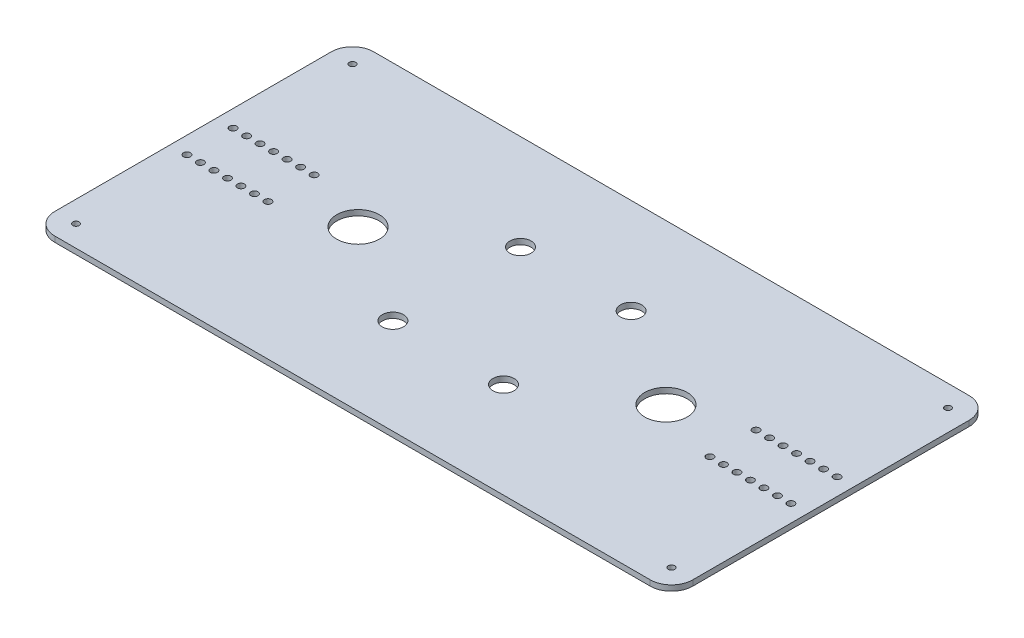
from build123d import *

# Parameters (mm, degrees)
SKETCH1_W               = 300
SKETCH1_H               = 150
BOSS_EXTRUDE1_DEPTH     = 2.6
FILLET1_R               = 10
SKETCH8_R               = 1.65
CUT_EXTRUDE4_DEPTH      = 2.6
LPATTERN1_COUNT         = 7
LPATTERN1_PITCH         = 6.35
MIRROR1_COPY_1_SKETCH_R = 1.65
MIRROR1_COPY_1_DEPTH    = 2.6
MIRROR1_COPY_2_SKETCH_R = 1.65
MIRROR1_COPY_2_DEPTH    = 2.6
MIRROR1_COPY_3_SKETCH_R = 1.65
MIRROR1_COPY_3_DEPTH    = 2.6
MIRROR1_COPY_4_SKETCH_R = 1.65
MIRROR1_COPY_4_DEPTH    = 2.6
MIRROR1_COPY_5_SKETCH_R = 1.65
MIRROR1_COPY_5_DEPTH    = 2.6
MIRROR1_COPY_6_SKETCH_R = 1.65
MIRROR1_COPY_6_DEPTH    = 2.6
SKETCH6_R               = 1.5
CUT_EXTRUDE6_DEPTH      = 2.6
MIRROR6_COPY_1_SKETCH_R = 1.5
MIRROR6_COPY_1_DEPTH    = 2.6
SKETCH13_R              = 4.980627928
CUT_EXTRUDE7_DEPTH      = 2.6
MIRROR8_COPY_1_SKETCH_R = 4.980627928
MIRROR8_COPY_1_DEPTH    = 2.6
SKETCH15_R              = 10
CUT_EXTRUDE8_DEPTH      = 2.6


with BuildPart() as part:
    # Sketch1 → Boss-Extrude1 (new body)
    with BuildSketch(Plane(origin=(0, 0, 0), x_dir=(1, 0, 0), z_dir=(0, 1, 0))):
        with Locations((150, -75)):
            Rectangle(SKETCH1_W, SKETCH1_H)
    extrude(amount=BOSS_EXTRUDE1_DEPTH)

    # Fillet1
    fillet1_edges = [part.edges().sort_by_distance(p)[0] for p in [
        (0, 1.3, 0),
        (300, 1.3, 0),
        (300, 1.3, 150),
        (0, 1.3, 150),
    ]]
    fillet(fillet1_edges, radius=FILLET1_R)

    # Sketch8 → Cut-Extrude4 (cut)
    with BuildSketch(Plane.XZ):
        with Locations(Location((292, 85.85, 0), (0, 0, 270))):
            Circle(SKETCH8_R)
        with Locations(Location((292, 64.15, 0), (0, 0, 270))):
            Circle(SKETCH8_R)
    cut_extrude4 = extrude(amount=-CUT_EXTRUDE4_DEPTH, mode=Mode.SUBTRACT)

    # LPattern1: Cut-Extrude4 ×7
    with Locations(*[(-i * LPATTERN1_PITCH, 0, 0) for i in range(1, LPATTERN1_COUNT)]):
        add(cut_extrude4, mode=Mode.SUBTRACT)

    # Mirror1: Cut-Extrude4 across plane
    add(cut_extrude4.mirror(Plane(origin=(150, 0, 0), x_dir=(0, 0, 1), z_dir=(1, 0, 0))), mode=Mode.SUBTRACT)

    # Mirror1 copy 1 sketch → Mirror1 copy 1 (cut)
    with BuildSketch(Plane(origin=(306.35, 0, 0), x_dir=(-1, 0, 0), z_dir=(0, -1, 0))):
        with Locations((292, -85.85)):
            Circle(MIRROR1_COPY_1_SKETCH_R)
        with Locations((292, -64.15)):
            Circle(MIRROR1_COPY_1_SKETCH_R)
    extrude(amount=-MIRROR1_COPY_1_DEPTH, mode=Mode.SUBTRACT)

    # Mirror1 copy 2 sketch → Mirror1 copy 2 (cut)
    with BuildSketch(Plane(origin=(312.7, 0, 0), x_dir=(-1, 0, 0), z_dir=(0, -1, 0))):
        with Locations((292, -85.85)):
            Circle(MIRROR1_COPY_2_SKETCH_R)
        with Locations((292, -64.15)):
            Circle(MIRROR1_COPY_2_SKETCH_R)
    extrude(amount=-MIRROR1_COPY_2_DEPTH, mode=Mode.SUBTRACT)

    # Mirror1 copy 3 sketch → Mirror1 copy 3 (cut)
    with BuildSketch(Plane(origin=(319.05, 0, 0), x_dir=(-1, 0, 0), z_dir=(0, -1, 0))):
        with Locations((292, -85.85)):
            Circle(MIRROR1_COPY_3_SKETCH_R)
        with Locations((292, -64.15)):
            Circle(MIRROR1_COPY_3_SKETCH_R)
    extrude(amount=-MIRROR1_COPY_3_DEPTH, mode=Mode.SUBTRACT)

    # Mirror1 copy 4 sketch → Mirror1 copy 4 (cut)
    with BuildSketch(Plane(origin=(325.4, 0, 0), x_dir=(-1, 0, 0), z_dir=(0, -1, 0))):
        with Locations((292, -85.85)):
            Circle(MIRROR1_COPY_4_SKETCH_R)
        with Locations((292, -64.15)):
            Circle(MIRROR1_COPY_4_SKETCH_R)
    extrude(amount=-MIRROR1_COPY_4_DEPTH, mode=Mode.SUBTRACT)

    # Mirror1 copy 5 sketch → Mirror1 copy 5 (cut)
    with BuildSketch(Plane(origin=(331.75, 0, 0), x_dir=(-1, 0, 0), z_dir=(0, -1, 0))):
        with Locations((292, -85.85)):
            Circle(MIRROR1_COPY_5_SKETCH_R)
        with Locations((292, -64.15)):
            Circle(MIRROR1_COPY_5_SKETCH_R)
    extrude(amount=-MIRROR1_COPY_5_DEPTH, mode=Mode.SUBTRACT)

    # Mirror1 copy 6 sketch → Mirror1 copy 6 (cut)
    with BuildSketch(Plane(origin=(338.1, 0, 0), x_dir=(-1, 0, 0), z_dir=(0, -1, 0))):
        with Locations((292, -85.85)):
            Circle(MIRROR1_COPY_6_SKETCH_R)
        with Locations((292, -64.15)):
            Circle(MIRROR1_COPY_6_SKETCH_R)
    extrude(amount=-MIRROR1_COPY_6_DEPTH, mode=Mode.SUBTRACT)

    # Sketch6 → Cut-Extrude6 (cut)
    with BuildSketch(Plane.XZ):
        with Locations(Location((290, 10, 0), (0, 0, 270))):
            Circle(SKETCH6_R)
    cut_extrude6 = extrude(amount=-CUT_EXTRUDE6_DEPTH, mode=Mode.SUBTRACT)

    # Mirror5: Cut-Extrude6 across plane
    add(cut_extrude6.mirror(Plane(origin=(150, 0, 0), x_dir=(0, 0, 1), z_dir=(1, 0, 0))), mode=Mode.SUBTRACT)

    # Mirror6: Cut-Extrude6 across plane
    add(cut_extrude6.mirror(Plane.XY.offset(75)), mode=Mode.SUBTRACT)

    # Mirror6 copy 1 sketch → Mirror6 copy 1 (cut)
    with BuildSketch(Plane(origin=(300, 0, 150), x_dir=(-1, 0, 0), z_dir=(0, -1, 0))):
        with Locations(Location((290, 10, 0), (0, 0, 270))):
            Circle(MIRROR6_COPY_1_SKETCH_R)
    extrude(amount=-MIRROR6_COPY_1_DEPTH, mode=Mode.SUBTRACT)

    # Sketch13 → Cut-Extrude7 (cut)
    with BuildSketch(Plane(origin=(0, 2.6, 0), x_dir=(1, 0, 0), z_dir=(0, 1, 0))):
        with Locations(Location((124, -105, 0), (0, 0, 270))):
            Circle(SKETCH13_R)
    cut_extrude7 = extrude(amount=-CUT_EXTRUDE7_DEPTH, mode=Mode.SUBTRACT)

    # Mirror7: Cut-Extrude7 across plane
    add(cut_extrude7.mirror(Plane.XY.offset(75)), mode=Mode.SUBTRACT)

    # Mirror8: Cut-Extrude7 across plane
    add(cut_extrude7.mirror(Plane(origin=(150, 0, 0), x_dir=(0, 0, 1), z_dir=(1, 0, 0))), mode=Mode.SUBTRACT)

    # Mirror8 copy 1 sketch → Mirror8 copy 1 (cut)
    with BuildSketch(Plane(origin=(300, 2.6, 150), x_dir=(-1, 0, 0), z_dir=(0, 1, 0))):
        with Locations(Location((124, -105, 0), (0, 0, 270))):
            Circle(MIRROR8_COPY_1_SKETCH_R)
    extrude(amount=-MIRROR8_COPY_1_DEPTH, mode=Mode.SUBTRACT)

    # Sketch15 → Cut-Extrude8 (cut)
    with BuildSketch(Plane.XZ):
        with Locations(Location((77.600932522, 75, 0), (0, 0, 270))):
            Circle(SKETCH15_R)
    cut_extrude8 = extrude(amount=-CUT_EXTRUDE8_DEPTH, mode=Mode.SUBTRACT)

    # Mirror9: Cut-Extrude8 across plane
    add(cut_extrude8.mirror(Plane(origin=(150, 0, 0), x_dir=(0, 0, 1), z_dir=(1, 0, 0))), mode=Mode.SUBTRACT)


solid = part.part
